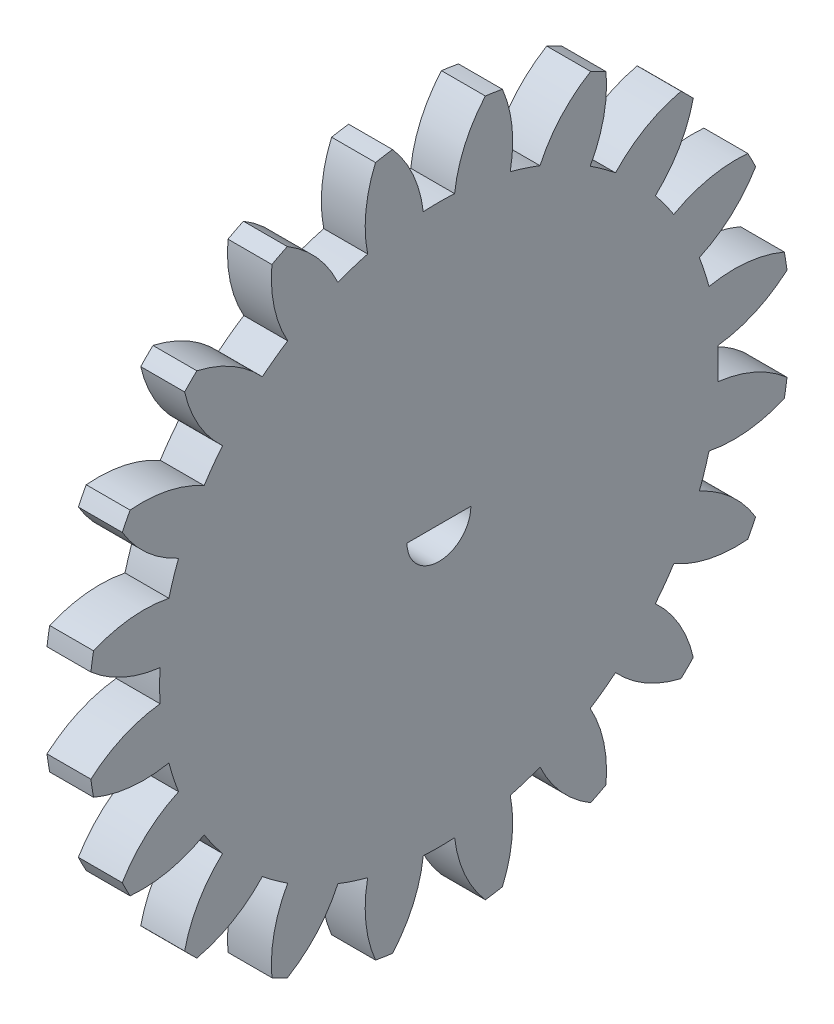
from build123d import *

# Parameters (mm, degrees)
BASPROSKE_W             = 5.5
BASPROSKE_H             = 44
TOOTHCUT_DEPTH          = 63.467991804
TEETHCUTS_COUNT         = 20
TEETHCUTS_ANGLE         = 342
BORSKE_R                = 0.5
BORE_DEPTH              = 50.0000508
CORTAR_EXTRUIR1_DEPTH   = 5.5
SALIENTE_EXTRUIR1_DEPTH = 5.5


with BuildPart() as part:
    # BasProSke → Base-Revolve (revolve)
    with BuildSketch(Plane(origin=(0, 0, 0), x_dir=(1, 0, 0), z_dir=(0, 1, 0)), mode=Mode.PRIVATE) as base_revolve_sk:
        with Locations((2.75, 22)):
            Rectangle(BASPROSKE_W, BASPROSKE_H)
    revolve(base_revolve_sk.sketch.rotate(Axis((-10, 0, 0), (1, 0, 0)), 180), axis=Axis((-10, 0, 0), (1, 0, 0)))

    # TooCutSke → ToothCut (cut, through all)
    with BuildSketch(Plane(origin=(0, 0, 0), x_dir=(0, 0, -1), z_dir=(1, 0, 0))):
        with BuildLine():
            ThreePointArc((1.961730392, 34.943978235), (0, 34.999), (-1.961730392, 34.943978235))
            ThreePointArc((-1.961730392, 34.943978235), (-3.235659864, 39.585086827), (-5.832115241, 43.637395396))
            ThreePointArc((-5.832115241, 43.637395396), (0, 44.0254), (5.832115241, 43.637395396))
            ThreePointArc((5.832115241, 43.637395396), (3.235659864, 39.585086827), (1.961730392, 34.943978235))
        make_face()
    toothcut = extrude(amount=TOOTHCUT_DEPTH, mode=Mode.SUBTRACT)

    # TeethCuts: ToothCut ×20 about axis
    teethcuts_axis = Axis((-10, 0, 0), (1, 0, 0))
    for i in range(1, TEETHCUTS_COUNT):
        add(toothcut.rotate(teethcuts_axis, i * TEETHCUTS_ANGLE / (TEETHCUTS_COUNT - 1)), mode=Mode.SUBTRACT)

    # BorSke → Bore (cut, symmetric)
    with BuildSketch(Plane(origin=(0, 0, 0), x_dir=(0, 0, -1), z_dir=(1, 0, 0))):
        with Locations(Location((0, 0, 0), (0, 0, 180))):
            Circle(BORSKE_R)
    extrude(amount=BORE_DEPTH, both=True, mode=Mode.SUBTRACT)

    # Croquis1 → Cortar-Extruir1 (cut)
    with BuildSketch(Plane(origin=(5.5, 0, 0), x_dir=(0, 0, -1), z_dir=(1, 0, 0))):
        with BuildLine():
            Line((-4, 0), (4, 0))
            ThreePointArc((4, 0), (0, -4), (-4, 0))
        make_face()
    extrude(amount=-CORTAR_EXTRUIR1_DEPTH, mode=Mode.SUBTRACT)

    # Croquis2 → Saliente-Extruir1 (add)
    with BuildSketch(Plane(origin=(5.5, 0, 0), x_dir=(0, 0, -1), z_dir=(1, 0, 0))):
        with BuildLine():
            Line((-0.5, 0), (0.5, 0))
            ThreePointArc((0.5, 0), (0, 0.5), (-0.5, 0))
        make_face()
    extrude(amount=-SALIENTE_EXTRUIR1_DEPTH)


solid = part.part
